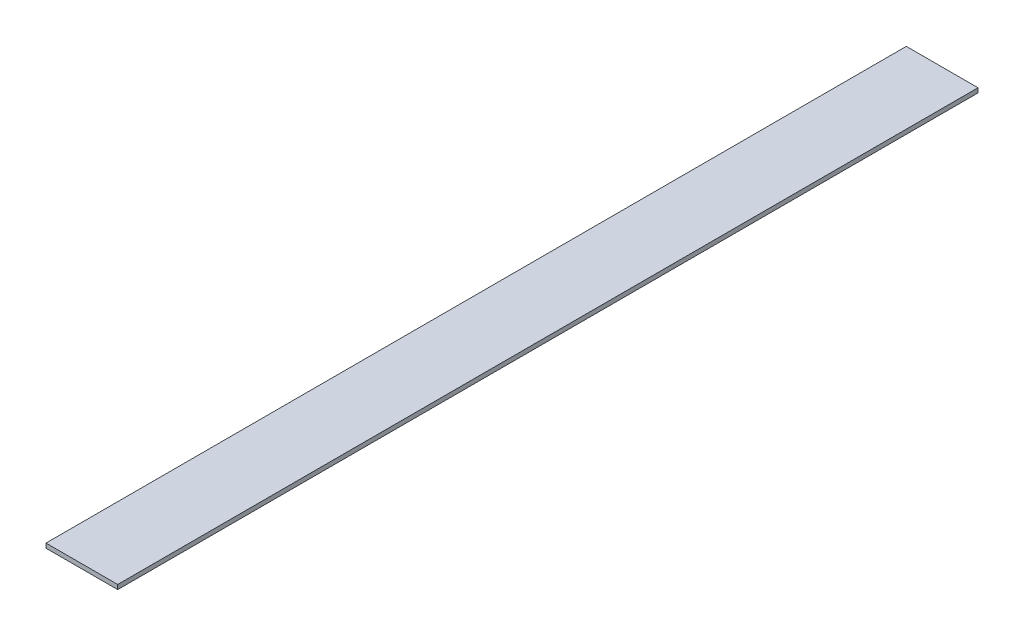
from build123d import *

# Parameters (mm, degrees)
SKETCH1_W           = 25.4
SKETCH1_H           = 304.8
BOSS_EXTRUDE1_DEPTH = 1.5875


with BuildPart() as part:
    # Sketch1 → Boss-Extrude1 (new body)
    with BuildSketch(Plane(origin=(0, 0, 0), x_dir=(1, 0, 0), z_dir=(0, 1, 0))):
        Rectangle(SKETCH1_W, SKETCH1_H)
    extrude(amount=BOSS_EXTRUDE1_DEPTH)


solid = part.part
